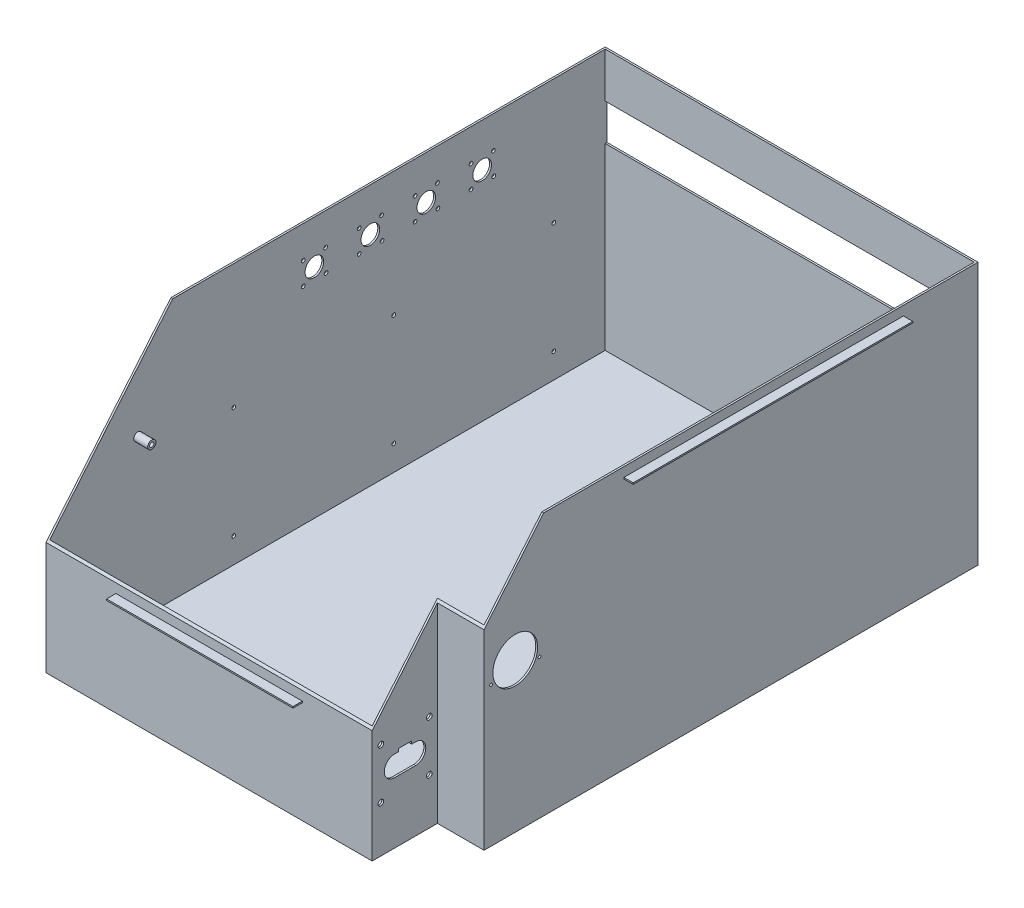
from build123d import *

# Parameters (mm, degrees)
BOSS_EXTRUDE1_DEPTH     = 1.5
BOSS_EXTRUDE2_DEPTH     = 280
SKETCH4_W               = 400
SKETCH4_H               = 42.385541564
BOSS_EXTRUDE3_DEPTH     = 2
CUT_EXTRUDE1_DEPTH      = 609.61485268
CUT_EXTRUDE1_DEPTH_BACK = 609.61485268
SKETCH8_R               = 4.39
SKETCH8_R_2             = 2.39
BOSS_EXTRUDE5_DEPTH     = 15
SKETCH10_R              = 3
CUT_EXTRUDE2_DEPTH      = 2
SKETCH15_W              = 15
SKETCH15_H              = 1.5
BOSS_EXTRUDE6_DEPTH     = 15
BOSS_EXTRUDE7_DEPTH     = 1.5
BOSS_EXTRUDE8_DEPTH     = 1.5
SKETCH20_R              = 2.415919743
SKETCH20_R_2            = 2
CUT_EXTRUDE5_DEPTH      = 1.5
SKETCH5_R               = 2
SKETCH5_R_2             = 10
CUT_EXTRUDE7_DEPTH      = 2
SKETCH21_W              = 300
SKETCH21_H              = 1.5
BOSS_EXTRUDE9_DEPTH     = 10
SKETCH22_W              = 300
SKETCH22_H              = 1.5
BOSS_EXTRUDE10_DEPTH    = 10
BOSS_EXTRUDE11_DEPTH    = 0.75
BOSS_EXTRUDE12_DEPTH    = 0.75
BOSS_EXTRUDE13_DEPTH    = 0.75
BOSS_EXTRUDE14_DEPTH    = 0.75
SKETCH27_W              = 200
SKETCH27_H              = 1.5
BOSS_EXTRUDE15_DEPTH    = 10
BOSS_EXTRUDE16_DEPTH    = 0.75
BOSS_EXTRUDE17_DEPTH    = 0.75
SKETCH30_R              = 24
SKETCH30_R_2            = 1.5
CUT_EXTRUDE8_DEPTH      = 2
SKETCH33_R              = 2
CUT_EXTRUDE9_DEPTH      = 2
SKETCH42_W              = 396
SKETCH42_H              = 39.39
CUT_EXTRUDE13_DEPTH     = 40


with BuildPart() as part:
    # Sketch1 → Boss-Extrude1 (new body)
    with BuildSketch(Plane(origin=(0, 0, 0), x_dir=(1, 0, 0), z_dir=(0, 1, 0))):
        Polygon((-200, 237.826300096), (200, 237.826300096), (200, -292.173699904), (150, -292.173699904), (150, -362.173699904), (-200, -362.173699904), align=None)
    extrude(amount=BOSS_EXTRUDE1_DEPTH)

    # Sketch2 → Boss-Extrude2 (add)
    with BuildSketch(Plane(origin=(0, 1.5, 0), x_dir=(1, 0, 0), z_dir=(0, 1, 0))):
        Polygon((-200, 237.826300096), (-200, -362.173699904), (150, -362.173699904), (150, -292.173699904), (200, -292.173699904), (200, 237.826300096), align=None)
        Polygon((-198, 235.826300096), (-198, -360.173699904), (148, -360.173699904), (148, -290.173699904), (198, -290.173699904), (198, 235.826300096), align=None, mode=Mode.SUBTRACT)
    extrude(amount=BOSS_EXTRUDE2_DEPTH)

    # Sketch4 → Boss-Extrude3 (add)
    with BuildSketch(Plane(origin=(0, 0, -237.826300096), x_dir=(-1, 0, 0), z_dir=(0, 0, -1))):
        with Locations((0, 213.483316708)):
            Rectangle(SKETCH4_W, SKETCH4_H)
    extrude(amount=-BOSS_EXTRUDE3_DEPTH)

    # Sketch3 → Cut-Extrude1 (cut, two sides: drawn at the far end of the back side and taken through both)
    with BuildSketch(Plane.ZY.offset(200).offset(-CUT_EXTRUDE1_DEPTH_BACK)):
        Polygon((362.173699904, 121.117558148), (228.195222706, 281.5), (362.173699904, 281.5), align=None)
    extrude(amount=CUT_EXTRUDE1_DEPTH + CUT_EXTRUDE1_DEPTH_BACK, mode=Mode.SUBTRACT)

    # Sketch8 → Boss-Extrude5 (add)
    # profile 1 of 2: a face of its own
    with BuildSketch(Plane(origin=(-198, 0, 0), x_dir=(0, 0, -1), z_dir=(1, 0, 0))):
        with Locations((-265.673697326, 172.19919718)):
            Circle(SKETCH8_R)
        with Locations((-265.673697326, 172.19919718)):
            Circle(SKETCH8_R_2, mode=Mode.SUBTRACT)
    # profile 2 of 2: a face of its own
    with BuildSketch(Plane(origin=(-198, 0, 0), x_dir=(0, 0, -1), z_dir=(1, 0, 0))):
        with Locations((-265.173699904, 16.5)):
            Circle(SKETCH8_R)
        with Locations((-265.173699904, 16.5)):
            Circle(SKETCH8_R_2, mode=Mode.SUBTRACT)
    extrude(amount=BOSS_EXTRUDE5_DEPTH)

    # Sketch10 → Cut-Extrude2 (cut)
    with BuildSketch(Plane.ZY.offset(-148)):
        with BuildLine():
            Line((333.923699904, 90.5), (319.923699904, 90.5))
            Line((319.923699904, 90.5), (319.923699904, 87.5))
            Line((319.923699904, 87.5), (315.673699904, 87.5))
            ThreePointArc((315.673699904, 87.5), (304.673699904, 76.5), (315.673699904, 65.5))
            Line((315.673699904, 65.5), (338.173699904, 65.5))
            ThreePointArc((338.173699904, 65.5), (349.173699904, 76.5), (338.173699904, 87.5))
            Line((338.173699904, 87.5), (333.923699904, 87.5))
            Line((333.923699904, 87.5), (333.923699904, 90.5))
        make_face()
        with Locations((300.973699904, 103.45)):
            Circle(SKETCH10_R)
        with Locations((352.873699904, 103.45)):
            Circle(SKETCH10_R)
        with Locations((300.973699904, 49.55)):
            Circle(SKETCH10_R)
        with Locations((352.873699904, 49.55)):
            Circle(SKETCH10_R)
    extrude(amount=-CUT_EXTRUDE2_DEPTH, mode=Mode.SUBTRACT)

    # Sketch15 → Boss-Extrude6 (add)
    with BuildSketch(Plane.ZY.offset(-198)):
        with Locations((-216.326300096, 251.386283415)):
            Rectangle(SKETCH15_W, SKETCH15_H)
        with Locations((203.673699904, 251.386283415)):
            Rectangle(SKETCH15_W, SKETCH15_H)
    extrude(amount=BOSS_EXTRUDE6_DEPTH)

    # Sketch17 → Boss-Extrude7 (add)
    with BuildSketch(Plane.XY.offset(-208.826300096)):
        Polygon((198, 250.636283415), (198, 235.636283415), (183, 250.636283415), align=None)
    extrude(amount=-BOSS_EXTRUDE7_DEPTH)

    # Sketch18 → Boss-Extrude8 (add)
    with BuildSketch(Plane.XY.offset(196.173699904)):
        Polygon((198, 250.636283415), (198, 235.636283415), (183, 250.636283415), align=None)
    extrude(amount=BOSS_EXTRUDE8_DEPTH)

    # Sketch20 → Cut-Extrude5 (cut)
    with BuildSketch(Plane(origin=(0, 252.136283415, 0), x_dir=(1, 0, 0), z_dir=(0, 1, 0))):
        with Locations(Location((190.5, 216.326300096, 0), (0, 0, 270))):
            Circle(SKETCH20_R)
        with Locations(Location((190.5, -203.673699904, 0), (0, 0, 270))):
            Circle(SKETCH20_R_2)
    extrude(amount=-CUT_EXTRUDE5_DEPTH, mode=Mode.SUBTRACT)

    # Sketch5 → Cut-Extrude7 (cut)
    with BuildSketch(Plane.ZY.offset(200)):
        with Locations((-115.826300096, 247.120648807)):
            Circle(SKETCH5_R)
        with Locations((-116.326300096, 223.125857706)):
            Circle(SKETCH5_R)
        with Locations((-91.826300096, 223.120648807)):
            Circle(SKETCH5_R)
        with Locations((-91.826300096, 247.120648807)):
            Circle(SKETCH5_R)
        with Locations((-103.826300096, 235.120648807)):
            Circle(SKETCH5_R_2)
        with Locations((-55.826300096, 247.120648807)):
            Circle(SKETCH5_R)
        with Locations((-56.326300096, 223.125857706)):
            Circle(SKETCH5_R)
        with Locations((-31.826300096, 223.120648807)):
            Circle(SKETCH5_R)
        with Locations((-31.826300096, 247.120648807)):
            Circle(SKETCH5_R)
        with Locations((-43.826300096, 235.120648807)):
            Circle(SKETCH5_R_2)
        with Locations((4.173699904, 247.120648807)):
            Circle(SKETCH5_R)
        with Locations((3.673699904, 223.125857706)):
            Circle(SKETCH5_R)
        with Locations((28.173699904, 223.120648807)):
            Circle(SKETCH5_R)
        with Locations((28.173699904, 247.120648807)):
            Circle(SKETCH5_R)
        with Locations((16.173699904, 235.120648807)):
            Circle(SKETCH5_R_2)
        with Locations((64.173699904, 247.120648807)):
            Circle(SKETCH5_R)
        with Locations((63.673699904, 223.125857706)):
            Circle(SKETCH5_R)
        with Locations((88.173699904, 223.120648807)):
            Circle(SKETCH5_R)
        with Locations((88.173699904, 247.120648807)):
            Circle(SKETCH5_R)
        with Locations((76.173699904, 235.120648807)):
            Circle(SKETCH5_R_2)
    extrude(amount=-CUT_EXTRUDE7_DEPTH, mode=Mode.SUBTRACT)

    # Sketch21 → Boss-Extrude9 (add)
    with BuildSketch(Plane(origin=(0, 0, -237.826300096), x_dir=(-1, 0, 0), z_dir=(0, 0, -1))):
        with Locations((0, 270.75)):
            Rectangle(SKETCH21_W, SKETCH21_H)
    extrude(amount=BOSS_EXTRUDE9_DEPTH)

    # Sketch22 → Boss-Extrude10 (add)
    with BuildSketch(Plane.ZY.offset(200)):
        with Locations((-7.826300096, 270.75)):
            Rectangle(SKETCH22_W, SKETCH22_H)
    boss_extrude10 = extrude(amount=BOSS_EXTRUDE10_DEPTH)

    # Sketch23 → Boss-Extrude11 (add, symmetric)
    with BuildSketch(Plane(origin=(0, 0, -77.826300096), x_dir=(-1, 0, 0), z_dir=(0, 0, -1))):
        Polygon((210, 270), (200, 270), (200, 260), align=None)
    boss_extrude11 = extrude(amount=BOSS_EXTRUDE11_DEPTH, both=True)

    # Sketch24 → Boss-Extrude12 (add, symmetric)
    with BuildSketch(Plane.XY.offset(52.173699904)):
        Polygon((-210, 270), (-200, 260), (-200, 270), align=None)
    boss_extrude12 = extrude(amount=BOSS_EXTRUDE12_DEPTH, both=True)

    # Sketch25 → Boss-Extrude13 (add, symmetric)
    with BuildSketch(Plane(origin=(100, 0, 0), x_dir=(0, 0, -1), z_dir=(1, 0, 0))):
        Polygon((247.826300096, 270), (237.826300096, 270), (237.826300096, 260), align=None)
    extrude(amount=BOSS_EXTRUDE13_DEPTH, both=True)

    # Sketch26 → Boss-Extrude14 (add, symmetric)
    with BuildSketch(Plane.ZY.offset(100)):
        Polygon((-247.826300096, 270), (-237.826300096, 260), (-237.826300096, 270), align=None)
    extrude(amount=BOSS_EXTRUDE14_DEPTH, both=True)

    # Mirror1: Boss-Extrude10, Boss-Extrude11, Boss-Extrude12 across plane
    add(boss_extrude10.mirror(Plane(origin=(0, 0, 0), x_dir=(0, 0, 1), z_dir=(1, 0, 0))))
    add(boss_extrude11.mirror(Plane(origin=(0, 0, 0), x_dir=(0, 0, 1), z_dir=(1, 0, 0))))
    add(boss_extrude12.mirror(Plane(origin=(0, 0, 0), x_dir=(0, 0, 1), z_dir=(1, 0, 0))))

    # Sketch27 → Boss-Extrude15 (add)
    with BuildSketch(Plane.XY.offset(362.173699904)):
        with Locations((-25, 110.367558148)):
            Rectangle(SKETCH27_W, SKETCH27_H)
    extrude(amount=BOSS_EXTRUDE15_DEPTH)

    # Sketch28 → Boss-Extrude16 (add, symmetric)
    with BuildSketch(Plane.ZY.offset(95)):
        Polygon((372.173699904, 109.617558148), (362.173699904, 109.617558148), (362.173699904, 99.617558148), align=None)
    extrude(amount=BOSS_EXTRUDE16_DEPTH, both=True)

    # Sketch29 → Boss-Extrude17 (add, symmetric)
    with BuildSketch(Plane(origin=(45, 0, 0), x_dir=(0, 0, -1), z_dir=(1, 0, 0))):
        Polygon((-372.173699904, 109.617558148), (-362.173699904, 99.617558148), (-362.173699904, 109.617558148), align=None)
    extrude(amount=BOSS_EXTRUDE17_DEPTH, both=True)

    # Sketch30 → Cut-Extrude8 (cut)
    with BuildSketch(Plane(origin=(200, 0, 0), x_dir=(0, 0, -1), z_dir=(1, 0, 0))):
        with Locations((-258.673699904, 160)):
            Circle(SKETCH30_R)
        with Locations((-284.673699904, 150)):
            Circle(SKETCH30_R_2)
        with Locations((-232.673699904, 150)):
            Circle(SKETCH30_R_2)
    extrude(amount=-CUT_EXTRUDE8_DEPTH, mode=Mode.SUBTRACT)

    # Sketch33 → Cut-Extrude9 (cut)
    with BuildSketch(Plane.ZY.offset(200)):
        with Locations((-180.626300096, 147.77)):
            Circle(SKETCH33_R)
        with Locations((-180.626300096, 28.39)):
            Circle(SKETCH33_R)
        with Locations((-8.926300096, 147.77)):
            Circle(SKETCH33_R)
        with Locations((-8.926300096, 28.39)):
            Circle(SKETCH33_R)
        with Locations((162.773699904, 147.77)):
            Circle(SKETCH33_R)
        with Locations((162.773699904, 28.39)):
            Circle(SKETCH33_R)
    extrude(amount=-CUT_EXTRUDE9_DEPTH, mode=Mode.SUBTRACT)

    # Sketch42 → Cut-Extrude13 (cut)
    with BuildSketch(Plane.XY.offset(-235.826300096)):
        with Locations((0, 213.485)):
            Rectangle(SKETCH42_W, SKETCH42_H)
    extrude(amount=-CUT_EXTRUDE13_DEPTH, mode=Mode.SUBTRACT)


solid = part.part
